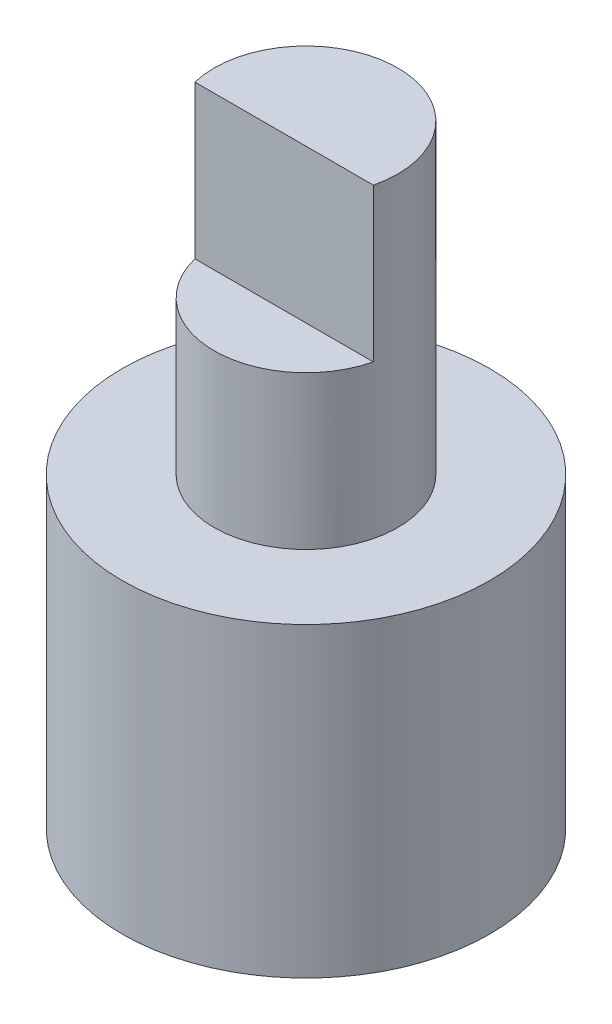
from build123d import *

# Parameters (mm, degrees)
SKETCH2_R           = 3
BOSS_EXTRUDE1_DEPTH = 5
SKETCH3_R           = 1.5
BOSS_EXTRUDE2_DEPTH = 5
CUT_EXTRUDE1_START  = -2.5
CUT_EXTRUDE1_DEPTH  = 2.5


with BuildPart() as part:
    # Sketch2 → Boss-Extrude1 (new body)
    with BuildSketch(Plane(origin=(0, 0, 0), x_dir=(1, 0, 0), z_dir=(0, 1, 0))):
        with Locations(Location((0, 0, 0), (0, 0, 270))):
            Circle(SKETCH2_R)
    extrude(amount=BOSS_EXTRUDE1_DEPTH)

    # Sketch3 → Boss-Extrude2 (add)
    with BuildSketch(Plane(origin=(0, 5, 0), x_dir=(1, 0, 0), z_dir=(0, 1, 0))):
        with Locations(Location((0, 0, 0), (0, 0, 270))):
            Circle(SKETCH3_R)
    extrude(amount=BOSS_EXTRUDE2_DEPTH)

    # Sketch4 → Cut-Extrude1 (cut)
    with BuildSketch(Plane(origin=(0, 10, 0), x_dir=(1, 0, 0), z_dir=(0, 1, 0)).offset(CUT_EXTRUDE1_START)):
        with BuildLine():
            Line((-1.456893676, -0.357016549), (1.456893676, -0.357016549))
            ThreePointArc((1.456893676, -0.357016549), (0, -1.5), (-1.456893676, -0.357016549))
        make_face()
    extrude(amount=CUT_EXTRUDE1_DEPTH, mode=Mode.SUBTRACT)


solid = part.part
